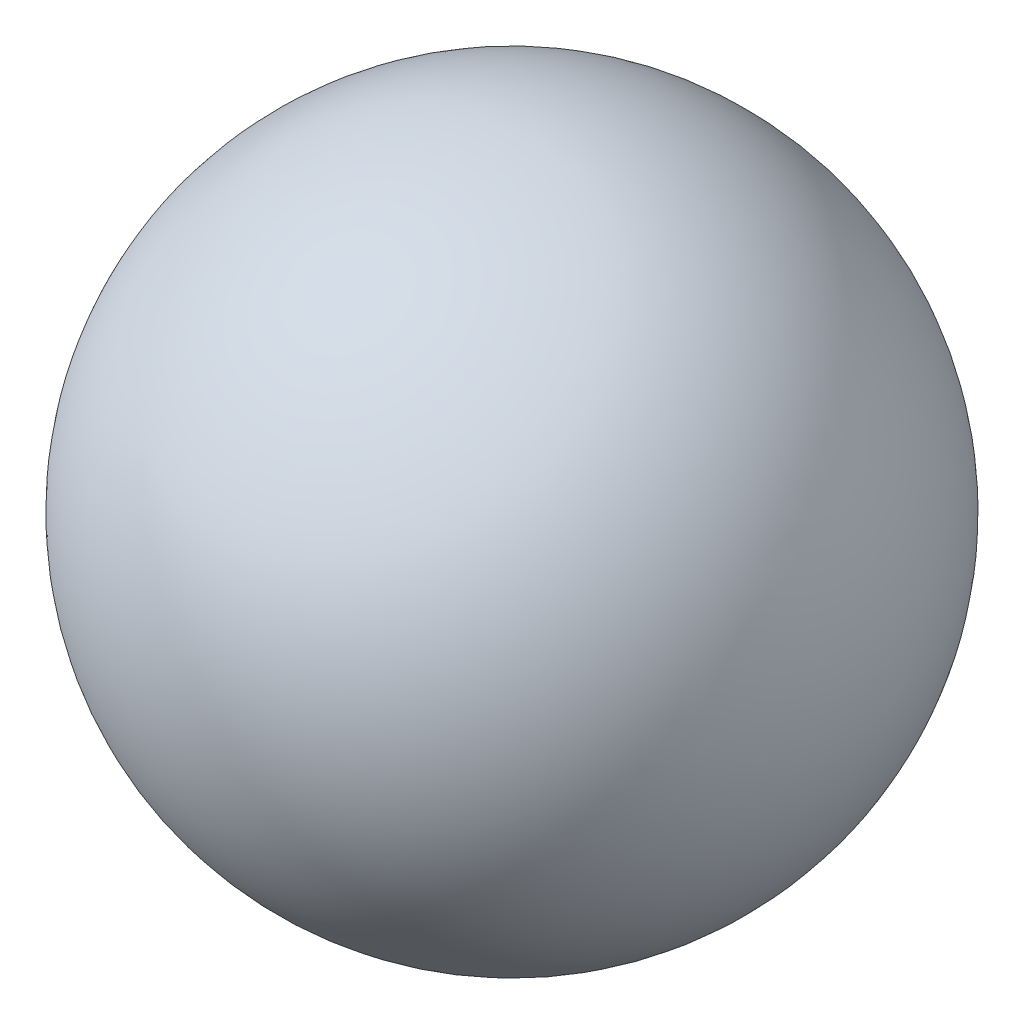
from build123d import *


with BuildPart() as part:
    # Esquisse1 → Révolution1 (revolve)
    with BuildSketch(Plane.XY):
        with BuildLine():
            Line((-21.5, 0), (21.5, 0))
            ThreePointArc((21.5, 0), (0, 21.5), (-21.5, 0))
        make_face()
    revolve(axis=Axis((-21.5, 0, 0), (1, 0, 0)))


solid = part.part
